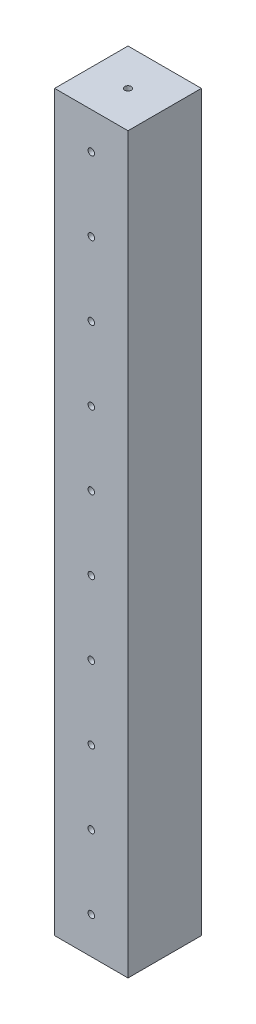
from build123d import *

# Parameters (mm, degrees)
SKETCH1_W                           = 25.4
SKETCH1_H                           = 25.4
BOSS_EXTRUDE1_DEPTH                 = 254
F_4_40_TAPPED_HOLE1_D               = 2.2606
F_4_40_TAPPED_HOLE1_DEPTH           = 7.6
F_4_40_TAPPED_HOLE1_TIP             = 0.679152758
F_4_40_TAPPED_HOLE1_ON_FACE_2_D     = 2.2606
F_4_40_TAPPED_HOLE1_ON_FACE_2_DEPTH = 7.6
F_4_40_TAPPED_HOLE1_ON_FACE_2_TIP   = 0.679152758
F_4_40_TAPPED_HOLE2_D               = 2.2606
LPATTERN1_COUNT                     = 10
LPATTERN1_PITCH                     = 25.4


with BuildPart() as part:
    # Sketch1 → Boss-Extrude1 (new body)
    with BuildSketch(Plane(origin=(0, 0, 0), x_dir=(1, 0, 0), z_dir=(0, 1, 0))):
        with Locations((12.7, -12.7)):
            Rectangle(SKETCH1_W, SKETCH1_H)
    extrude(amount=BOSS_EXTRUDE1_DEPTH)

    # #4-40 Tapped Hole1
    with Locations(Plane(origin=(12.7, 254, 12.7), x_dir=(0, 0, 1), z_dir=(0, 1, 0))):
        with Locations((0, 0)):
            Hole(F_4_40_TAPPED_HOLE1_D / 2, depth=F_4_40_TAPPED_HOLE1_DEPTH)
            with Locations((0, 0, -(F_4_40_TAPPED_HOLE1_DEPTH + F_4_40_TAPPED_HOLE1_TIP / 2))):  # 118° drill point
                Cone(0, F_4_40_TAPPED_HOLE1_D / 2, F_4_40_TAPPED_HOLE1_TIP, mode=Mode.SUBTRACT)

    # #4-40 Tapped Hole1 on face 2
    with Locations(Plane(origin=(12.7, 0, 12.7), x_dir=(0, 0, -1), z_dir=(0, -1, 0))):
        with Locations((0, 0)):
            Hole(F_4_40_TAPPED_HOLE1_ON_FACE_2_D / 2, depth=F_4_40_TAPPED_HOLE1_ON_FACE_2_DEPTH)
            with Locations((0, 0, -(F_4_40_TAPPED_HOLE1_ON_FACE_2_DEPTH + F_4_40_TAPPED_HOLE1_ON_FACE_2_TIP / 2))):  # 118° drill point
                Cone(0, F_4_40_TAPPED_HOLE1_ON_FACE_2_D / 2, F_4_40_TAPPED_HOLE1_ON_FACE_2_TIP, mode=Mode.SUBTRACT)

    # #4-40 Tapped Hole2 (through all)
    with Locations(Plane(origin=(12.7, 241.3, 0), x_dir=(-1, 0, 0), z_dir=(0, 0, -1))):
        with Locations((0, 0)):
            f_4_40_tapped_hole2 = Hole(F_4_40_TAPPED_HOLE2_D / 2)

    # LPattern1: #4-40 Tapped Hole2 ×10
    with Locations(*[(0, -i * LPATTERN1_PITCH, 0) for i in range(1, LPATTERN1_COUNT)]):
        add(f_4_40_tapped_hole2, mode=Mode.SUBTRACT)


solid = part.part
